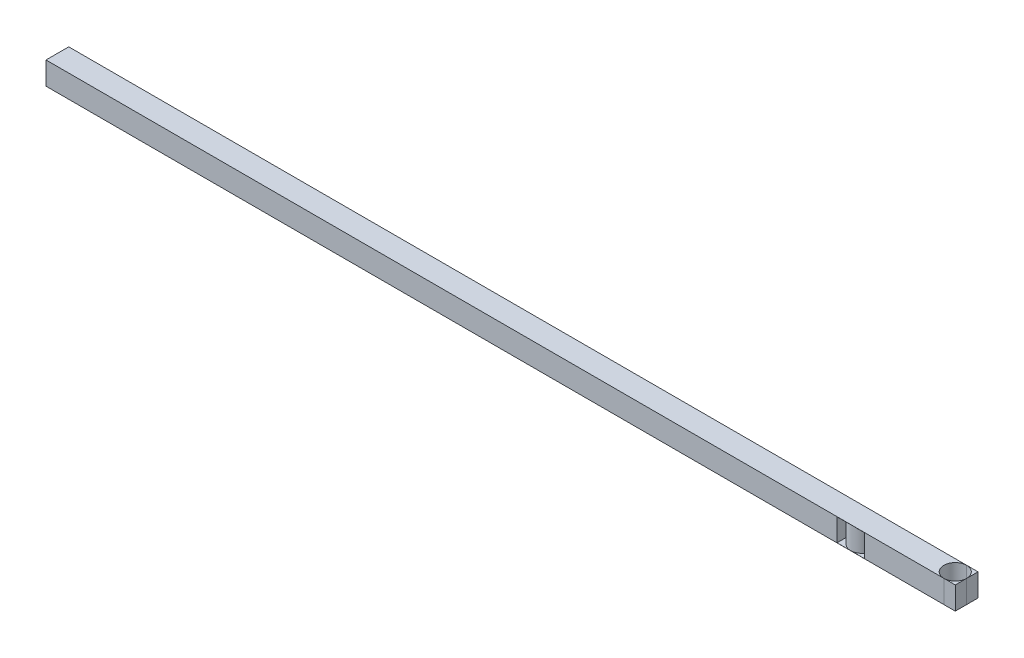
from build123d import *

# Parameters (mm, degrees)
SKETCH1_W           = 200
SKETCH1_H           = 5
BOSS_EXTRUDE1_DEPTH = 5
SKETCH3_R           = 2.5
BOSS_EXTRUDE3_DEPTH = 5
SKETCH6_R           = 2.5
CUT_EXTRUDE6_DEPTH  = 10
SKETCH7_R           = 2.5
CUT_EXTRUDE7_DEPTH  = 10
SKETCH8_W           = 6
SKETCH8_H           = 6
CUT_EXTRUDE8_DEPTH  = 2.475
BOSS_EXTRUDE4_REACH = 102.248
SKETCH9_R           = 2.5
SKETCH7_2_R         = 2.5
BOSS_EXTRUDE5_DEPTH = 5


with BuildPart() as part:
    # Sketch1 → Boss-Extrude1 (new body)
    with BuildSketch(Plane.XY):
        with Locations((0, -0.5)):
            Rectangle(SKETCH1_W, SKETCH1_H)
    extrude(amount=BOSS_EXTRUDE1_DEPTH)

    # Sketch3 → Boss-Extrude3 (add)
    with BuildSketch(Plane.XZ.offset(3)):
        with Locations((96.663551579, 2.5)):
            Circle(SKETCH3_R)
    extrude(amount=-BOSS_EXTRUDE3_DEPTH)

    # Sketch6 → Cut-Extrude6 (cut)
    with BuildSketch(Plane(origin=(0, 2, 0), x_dir=(1, 0, 0), z_dir=(0, 1, 0))):
        with Locations((97.5, -2.5)):
            Circle(SKETCH6_R)
    extrude(amount=-CUT_EXTRUDE6_DEPTH, mode=Mode.SUBTRACT)


with BuildPart() as cut_extrude6_piece_1:
    # of the separate pieces the step leaves, piece 1, a body of its own (cut_extrude6_pieces)
    add(part.part.solids().sort_by_distance((-100, 2, 0))[0])

    # Sketch7 → Cut-Extrude7 (cut)
    with BuildSketch(Plane(origin=(0, 2, 0), x_dir=(1, 0, 0), z_dir=(0, 1, 0))):
        with Locations((-97.5, -2.5)):
            Circle(SKETCH7_R)
    extrude(amount=-CUT_EXTRUDE7_DEPTH, mode=Mode.SUBTRACT)


with BuildPart() as cut_extrude6_piece_2:
    # of the separate pieces the step leaves, piece 2, a body of its own (cut_extrude6_pieces)
    add(part.part.solids().sort_by_distance((100, -3, 0))[0])


with BuildPart() as cut_extrude6_piece_3:
    # of the separate pieces the step leaves, piece 3, a body of its own (cut_extrude6_pieces)
    add(part.part.solids().sort_by_distance((100, 2, 5))[0])


with BuildPart() as cut_extrude7_piece_1:
    # of the separate pieces the step leaves, piece 1, a body of its own (cut_extrude7_pieces)
    add(cut_extrude6_piece_1.part.solids().sort_by_distance((97.5, 2, 0))[0])

    # Sketch8 → Cut-Extrude8 (cut, symmetric)
    with BuildSketch(Plane(origin=(0, -0.5, 0), x_dir=(-1, 0, 0), z_dir=(0, -1, 0))):
        with Locations((-77, -2.713256796)):
            Rectangle(SKETCH8_W, SKETCH8_H)
    extrude(amount=CUT_EXTRUDE8_DEPTH, both=True, mode=Mode.SUBTRACT)

    # Sketch9 → Boss-Extrude4 (add, up to next)
    with BuildSketch(Plane(origin=(0, -2.975, 0), x_dir=(1, 0, 0), z_dir=(0, 1, 0)), mode=Mode.PRIVATE) as boss_extrude4_sk1:
        with Locations(Location((77, -2.5, 0), (0, 0, 90))):
            Circle(SKETCH9_R)
    boss_extrude4_tool1 = extrude(boss_extrude4_sk1.sketch, amount=BOSS_EXTRUDE4_REACH, mode=Mode.PRIVATE) - cut_extrude7_piece_1.part
    add(boss_extrude4_tool1.solids().sort_by_distance((77, -2.975, 2.5))[0])



with BuildPart() as cut_extrude7_piece_2:
    # of the separate pieces the step leaves, piece 2, a body of its own (cut_extrude7_pieces)
    add(cut_extrude6_piece_1.part.solids().sort_by_distance((-100, 2, 0))[0])


with BuildPart() as cut_extrude7_piece_3:
    # of the separate pieces the step leaves, piece 3, a body of its own (cut_extrude7_pieces)
    add(cut_extrude6_piece_1.part.solids().sort_by_distance((-100, -3, 5))[0])


with BuildPart() as cut_extrude7_piece_1_1:
    add(cut_extrude7_piece_1.part)

    add(cut_extrude7_piece_2.part)  # Boss-Extrude5 merges Cut-Extrude7 piece 2

    add(cut_extrude7_piece_3.part)  # Boss-Extrude5 merges Cut-Extrude7 piece 3
    # Sketch7<2> → Boss-Extrude5 (add)
    with BuildSketch(Plane(origin=(0, 2, 0), x_dir=(1, 0, 0), z_dir=(0, 1, 0))):
        with Locations((-97.5, -2.5)):
            Circle(SKETCH7_2_R)
    extrude(amount=-BOSS_EXTRUDE5_DEPTH)


solid = Compound([cut_extrude6_piece_2.part, cut_extrude6_piece_3.part, cut_extrude7_piece_1_1.part])
